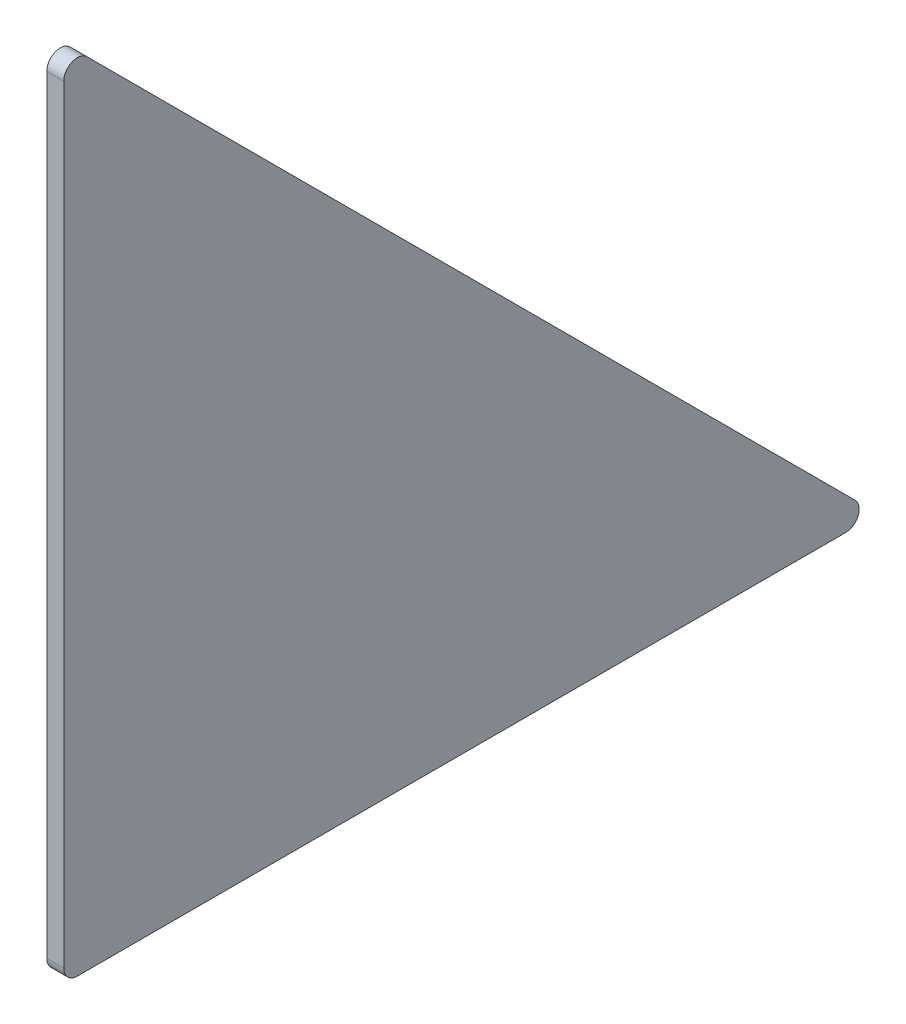
from build123d import *

# Parameters (mm, degrees)
BOSS_EXTRUDE1_DEPTH = 3.175
FILLET1_R           = 2.54


with BuildPart() as part:
    # Sketch1 → Boss-Extrude1 (new body)
    with BuildSketch(Plane(origin=(0, 0, 0), x_dir=(0, 0, -1), z_dir=(1, 0, 0))):
        Polygon((0, 0), (0, 152.4), (152.4, 0), align=None)
    extrude(amount=BOSS_EXTRUDE1_DEPTH)

    # Fillet1
    fillet1_edges = [part.edges().sort_by_distance(p)[0] for p in [
        (1.5875, 0, 0),
        (1.5875, 152.4, 0),
        (1.5875, 0, -152.4),
    ]]
    fillet(fillet1_edges, radius=FILLET1_R)


solid = part.part
